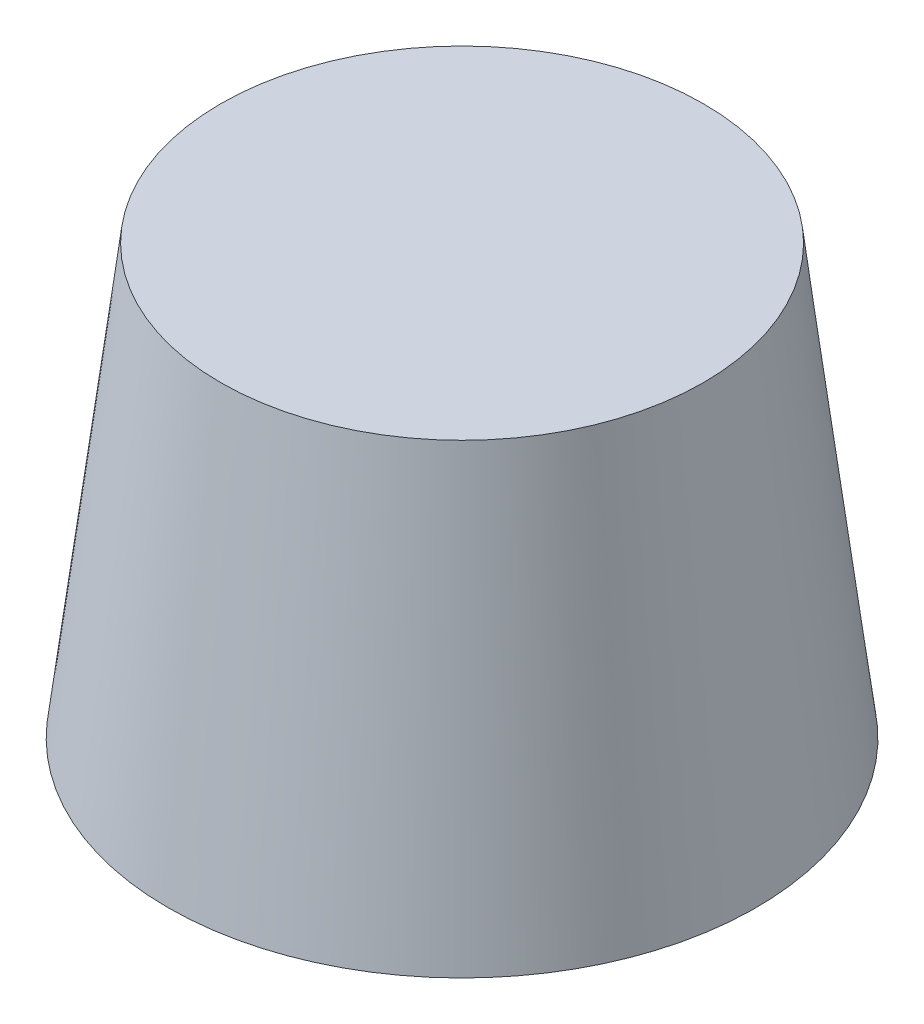
from build123d import *

# Parameters (mm, degrees)
SKETCH1_R            = 7.9375
CONE_DEPTH           = 6.35
CONE_TAPER           = 7
CONE_OTHER_WAY_DEPTH = 6.35
CONE_OTHER_WAY_TAPER = -7


with BuildPart() as part:
    # Sketch1 → cone (new body)
    with BuildSketch(Plane(origin=(0, 0, 0), x_dir=(1, 0, 0), z_dir=(0, 1, 0))):
        Circle(SKETCH1_R)
    extrude(amount=CONE_DEPTH, taper=CONE_TAPER)

    # Sketch1 → cone other way (add)
    with BuildSketch(Plane(origin=(0, 0, 0), x_dir=(1, 0, 0), z_dir=(0, 1, 0))):
        Circle(SKETCH1_R)
    extrude(amount=-CONE_OTHER_WAY_DEPTH, taper=CONE_OTHER_WAY_TAPER)


solid = part.part
